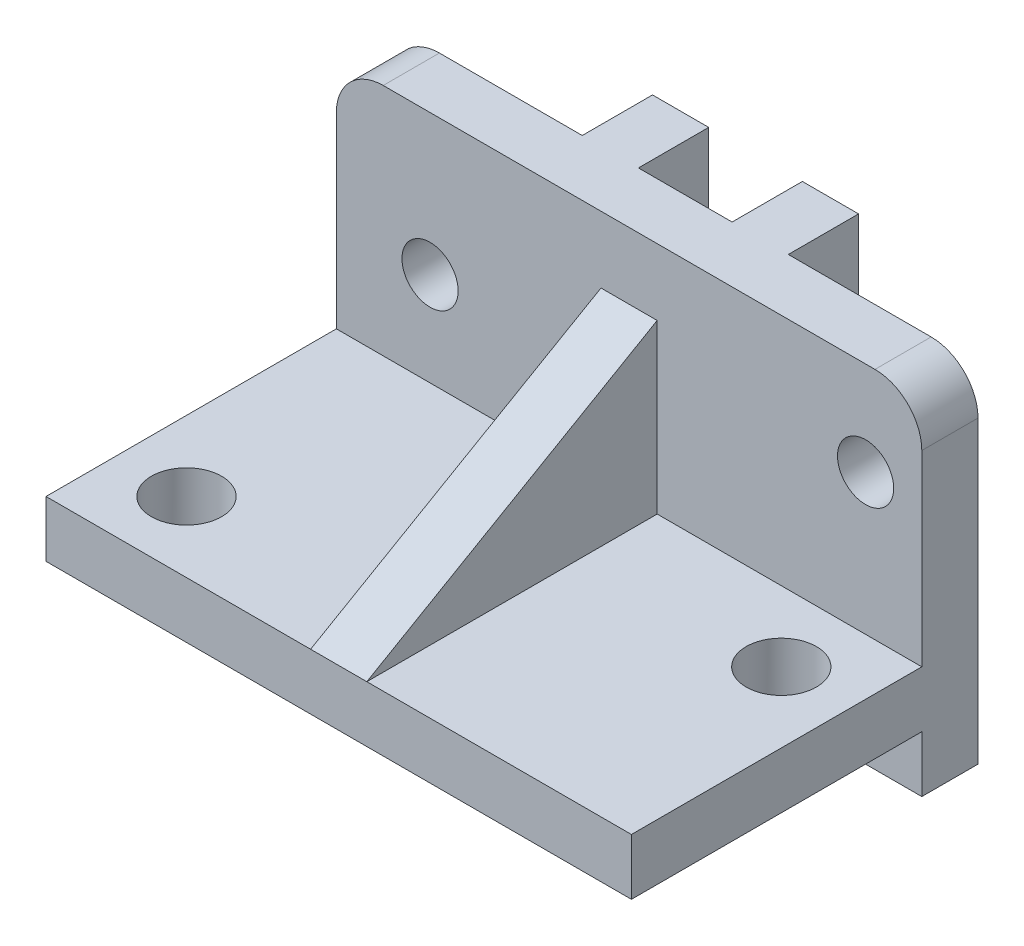
from build123d import *

# Parameters (mm, degrees)
BOSS_EXTRUDE1_DEPTH = 125
FILLET1_R           = 10
SKETCH2_W           = 12
SKETCH2_H           = 15
BOSS_EXTRUDE2_DEPTH = 74
SKETCH3_R           = 7.5
CUT_EXTRUDE1_DEPTH  = 162.387731876
SKETCH4_R           = 6
CUT_EXTRUDE2_DEPTH  = 153.685952203
BOSS_EXTRUDE3_DEPTH = 6


with BuildPart() as part:
    # Sketch1 → Boss-Extrude1 (new body)
    with BuildSketch(Plane(origin=(0, 0, 0), x_dir=(0, 0, -1), z_dir=(1, 0, 0))):
        Polygon((0, 0), (62, 0), (62, -12), (74, -12), (74, 62), (62, 62), (62, 12), (0, 12), align=None)
    extrude(amount=-BOSS_EXTRUDE1_DEPTH)

    # Fillet1
    fillet1_edges = [part.edges().sort_by_distance(p)[0] for p in [
        (-125, 62, -68),
        (0, 62, -68),
    ]]
    fillet(fillet1_edges, radius=FILLET1_R)

    # Sketch2 → Boss-Extrude2 (add)
    with BuildSketch(Plane(origin=(0, 62, 0), x_dir=(-1, 0, 0), z_dir=(0, -1, 0))):
        with Locations((78.5, 81.5)):
            Rectangle(SKETCH2_W, SKETCH2_H)
        with Locations((46.5, 81.5)):
            Rectangle(SKETCH2_W, SKETCH2_H)
    extrude(amount=BOSS_EXTRUDE2_DEPTH)

    # Sketch3 → Cut-Extrude1 (cut, through all)
    with BuildSketch(Plane(origin=(0, 12, 0), x_dir=(1, 0, 0), z_dir=(0, 1, 0))):
        with Locations(Location((-110, 15, 0), (0, 0, 270))):
            Circle(SKETCH3_R)
        with Locations(Location((-15, 47, 0), (0, 0, 270))):
            Circle(SKETCH3_R)
    extrude(amount=-CUT_EXTRUDE1_DEPTH, mode=Mode.SUBTRACT)

    # Sketch4 → Cut-Extrude2 (cut, through all)
    with BuildSketch(Plane.XY.offset(-62)):
        with Locations((-12, 42)):
            Circle(SKETCH4_R)
        with Locations((-105, 32)):
            Circle(SKETCH4_R)
    extrude(amount=-CUT_EXTRUDE2_DEPTH, mode=Mode.SUBTRACT)

    # Sketch5 → Boss-Extrude3 (add, symmetric)
    with BuildSketch(Plane(origin=(-62.5, 0, 0), x_dir=(0, 0, -1), z_dir=(1, 0, 0))):
        Polygon((0, 12), (62, 12), (62, 47.79571669), align=None)
    extrude(amount=BOSS_EXTRUDE3_DEPTH, both=True)


solid = part.part
